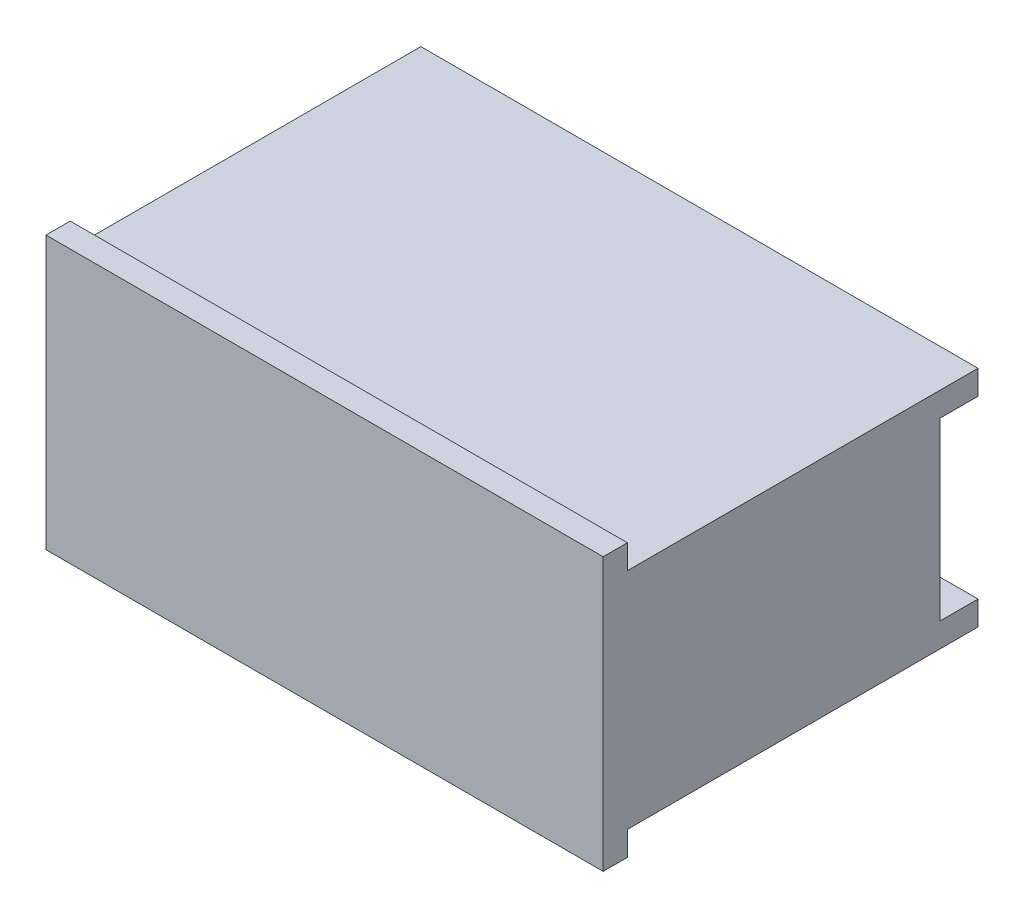
from build123d import *

# Parameters (mm, degrees)
IZIM1_W                     = 46
IZIM1_H                     = 18.5
Y_KSEKLIK_EKSTR_ZYON1_DEPTH = 30.95
IZIM2_W                     = 46
IZIM2_H                     = 14.5
KES_EKSTR_ZYON1_DEPTH       = 3.15
IZIM3_W                     = 46
IZIM3_H                     = 2
Y_KSEKLIK_EKSTR_ZYON2_DEPTH = 2
IZIM4_W                     = 46
IZIM4_H                     = 2
Y_KSEKLIK_EKSTR_ZYON3_DEPTH = 2


with BuildPart() as part:
    # Çizim1 → Yükseklik-Ekstrüzyon1 (new body)
    with BuildSketch(Plane.XY):
        Rectangle(IZIM1_W, IZIM1_H)
    extrude(amount=-Y_KSEKLIK_EKSTR_ZYON1_DEPTH)

    # Çizim2 → Kes-Ekstrüzyon1 (cut)
    with BuildSketch(Plane(origin=(0, 0, -30.95), x_dir=(-1, 0, 0), z_dir=(0, 0, -1))):
        Rectangle(IZIM2_W, IZIM2_H)
    extrude(amount=-KES_EKSTR_ZYON1_DEPTH, mode=Mode.SUBTRACT)

    # Çizim3 → Yükseklik-Ekstrüzyon2 (add)
    with BuildSketch(Plane.XZ.offset(9.25)):
        with Locations((0, -1)):
            Rectangle(IZIM3_W, IZIM3_H)
    extrude(amount=Y_KSEKLIK_EKSTR_ZYON2_DEPTH)

    # Çizim4 → Yükseklik-Ekstrüzyon3 (add)
    with BuildSketch(Plane(origin=(0, 9.25, 0), x_dir=(1, 0, 0), z_dir=(0, 1, 0))):
        with Locations((0, 1)):
            Rectangle(IZIM4_W, IZIM4_H)
    extrude(amount=Y_KSEKLIK_EKSTR_ZYON3_DEPTH)


solid = part.part
